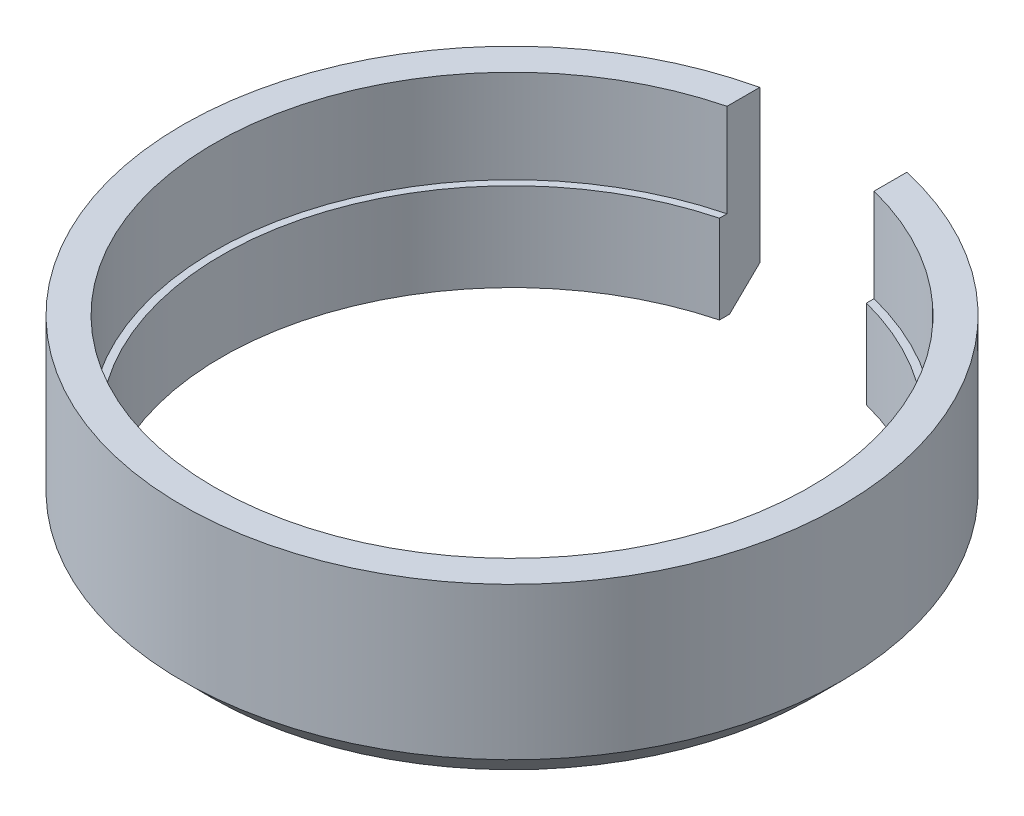
from build123d import *

# Parameters (mm, degrees)
CHAMFER_1_SIZE      = 1.2
CUT_EXTRUDE_1_REACH = 22.41
SKETCH_2_W          = 6
SKETCH_2_H          = 10


with BuildPart() as part:
    # Эскиз1 → Повернуть1 (revolve)
    with BuildSketch(Plane.XY, mode=Mode.PRIVATE) as revolve_1_sk:
        Polygon((-11.85, 0), (-13.45, 0), (-13.45, 7.4), (-12.15, 7.4), (-12.15, 3.6), (-11.85, 3.6), align=None)
    revolve(revolve_1_sk.sketch.rotate(Axis((0, 0, 0), (0, 1, 0)), 270), axis=Axis((0, 0, 0), (0, 1, 0)))

    # Фаска1
    chamfer_1_edges = [part.edges().sort_by_distance(p)[0] for p in [
        (0, 0, 13.45),
    ]]
    chamfer(chamfer_1_edges, length=CHAMFER_1_SIZE)

    # Эскиз2 → Вырез-Вытянуть1 (cut, up to next)
    with BuildSketch(Plane(origin=(0, 7.4, 0), x_dir=(1, 0, 0), z_dir=(0, 1, 0)), mode=Mode.PRIVATE) as cut_extrude_1_sk1:
        with Locations((0, 12)):
            Rectangle(SKETCH_2_W, SKETCH_2_H)
    cut_extrude_1_tool1 = extrude(cut_extrude_1_sk1.sketch, amount=-CUT_EXTRUDE_1_REACH, mode=Mode.PRIVATE) & part.part
    add(cut_extrude_1_tool1.solids().sort_by_distance((0, 7.4, -12))[0], mode=Mode.SUBTRACT)


solid = part.part
